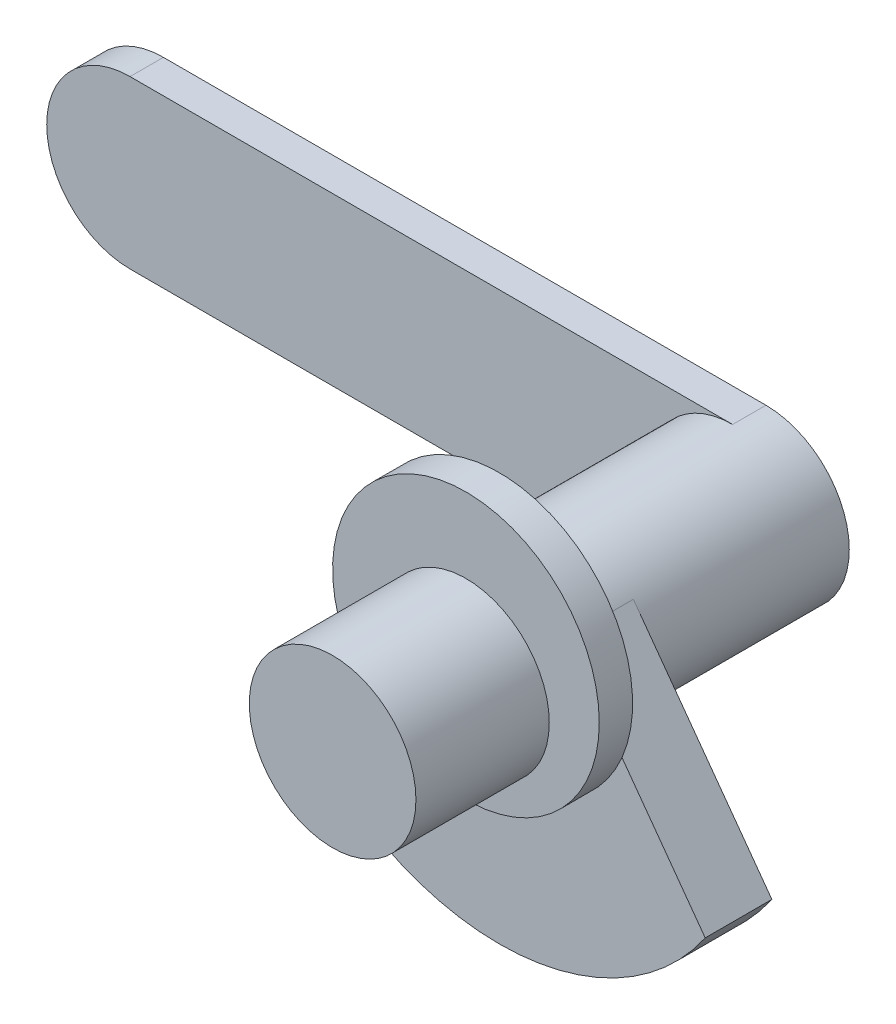
from build123d import *

# Parameters (mm, degrees)
BOSS_EXTRUDE1_DEPTH = 25.4
SKETCH3_R           = 63.5
BOSS_EXTRUDE2_DEPTH = 127
BOSS_EXTRUDE3_DEPTH = 50.8
SKETCH5_R           = 101.6
BOSS_EXTRUDE4_DEPTH = 25.4
SKETCH6_R           = 63.5
BOSS_EXTRUDE5_DEPTH = 101.6


with BuildPart() as part:
    # Sketch2 → Boss-Extrude1 (new body)
    with BuildSketch(Plane.XY):
        with BuildLine():
            Line((0, 63.5), (-459.135608438, 63.5))
            ThreePointArc((-459.135608438, 63.5), (-522.635608438, 0), (-459.135608438, -63.5))
            Line((-459.135608438, -63.5), (0, -63.5))
            ThreePointArc((0, -63.5), (63.5, 0), (0, 63.5))
        make_face()
    extrude(amount=BOSS_EXTRUDE1_DEPTH)

    # Sketch3 → Boss-Extrude2 (add)
    with BuildSketch(Plane.XY.offset(25.4)):
        with Locations(Location((0, 0, 0), (0, 0, 90))):
            Circle(SKETCH3_R)
    extrude(amount=BOSS_EXTRUDE2_DEPTH)

    # Sketch4 → Boss-Extrude3 (add)
    with BuildSketch(Plane.XY.offset(152.4)):
        with BuildLine():
            Line((-51.372579143, 37.324363521), (-156.920582469, -107.95))
            ThreePointArc((-156.920582469, -107.95), (0, -190.439904187), (156.920582469, -107.95))
            Line((156.920582469, -107.95), (51.372579143, 37.324363521))
            ThreePointArc((51.372579143, 37.324363521), (0, 63.5), (-51.372579143, 37.324363521))
        make_face()
    extrude(amount=BOSS_EXTRUDE3_DEPTH)

    # Sketch5 → Boss-Extrude4 (add)
    with BuildSketch(Plane.XY.offset(203.2)):
        with Locations(Location((0, 19.05, 0), (0, 0, 203.016562949))):
            Circle(SKETCH5_R)
    extrude(amount=BOSS_EXTRUDE4_DEPTH)

    # Sketch6 → Boss-Extrude5 (add)
    with BuildSketch(Plane.XY.offset(228.6)):
        with Locations(Location((0, 0, 0), (0, 0, 144))):
            Circle(SKETCH6_R)
    extrude(amount=BOSS_EXTRUDE5_DEPTH)


solid = part.part
